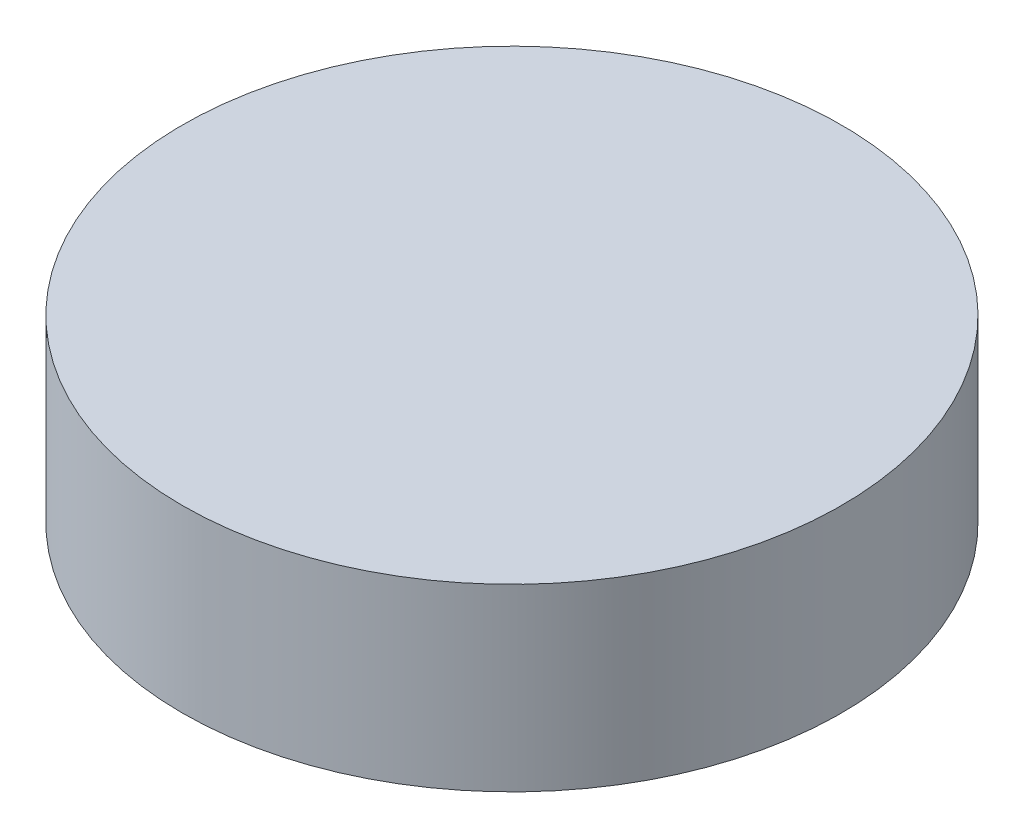
from build123d import *

# Parameters (mm, degrees)
SKETCH_1_R          = 5.5
EXTRUDE_1_DEPTH     = 3
SKETCH_2_R          = 2.5
CUT_EXTRUDE_1_DEPTH = 2


with BuildPart() as part:
    # 草图1 → 凸台-拉伸1 (new body)
    with BuildSketch(Plane(origin=(0, 0, 0), x_dir=(1, 0, 0), z_dir=(0, 1, 0))):
        with Locations(Location((0, 0, 0), (0, 0, 270))):
            Circle(SKETCH_1_R)
    extrude(amount=EXTRUDE_1_DEPTH)

    # 草图2 → 切除-拉伸1 (cut)
    with BuildSketch(Plane.XZ):
        with Locations(Location((0, 0, 0), (0, 0, 270))):
            Circle(SKETCH_2_R)
    extrude(amount=-CUT_EXTRUDE_1_DEPTH, mode=Mode.SUBTRACT)


solid = part.part
